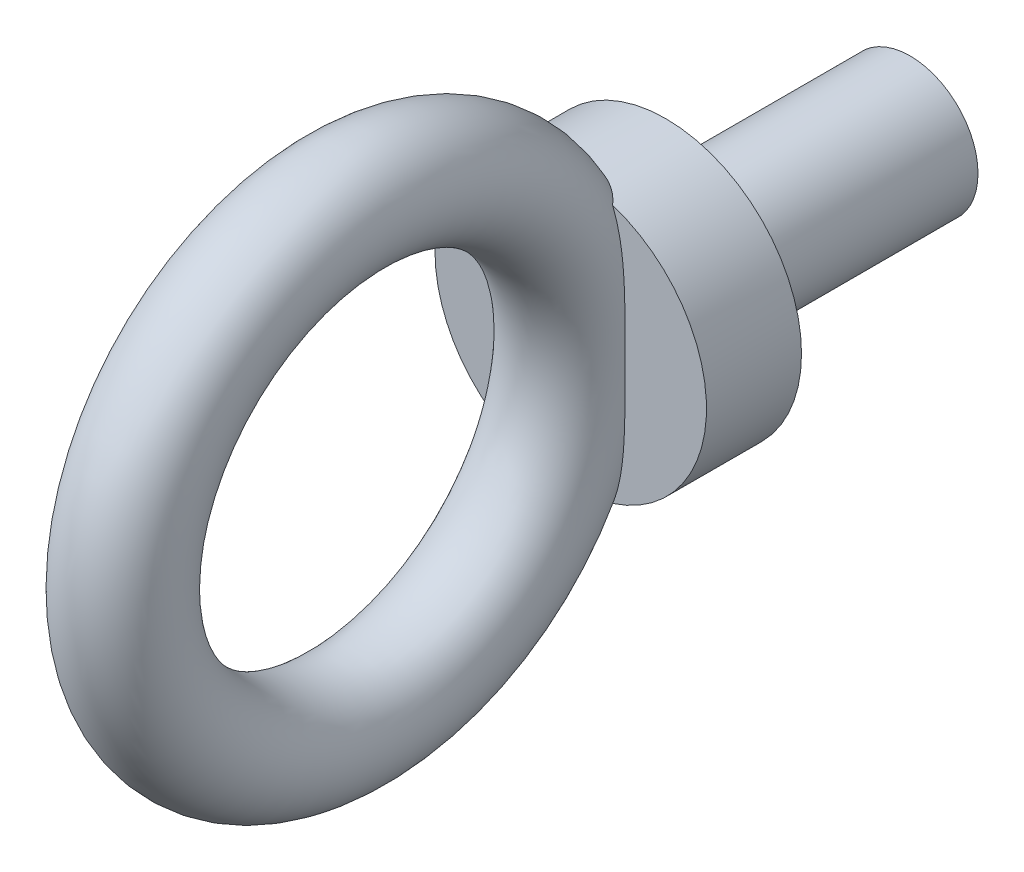
from build123d import *

# Parameters (mm, degrees)
SKETCH_1_R      = 5
EXTRUDE_1_DEPTH = 25
SKETCH_2_R      = 4
SKETCH_4_R      = 10
EXTRUDE_2_DEPTH = 7


with BuildPart() as part:
    # ｽｹｯﾁ1 → ﾎﾞｽ - 押し出し1 (new body)
    with BuildSketch(Plane.XY):
        Circle(SKETCH_1_R)
    extrude(amount=EXTRUDE_1_DEPTH)

    # ｽｲｰﾌﾟ1: sweep along a path in ｽｹｯﾁ3
    with BuildLine(Plane(origin=(0, 0, 0), x_dir=(0, 0, -1), z_dir=(1, 0, 0))) as sweep_1_path:
        CenterArc((-41.5, 0), 16.5, 0, 360)
    # ｽｹｯﾁ2 → ｽｲｰﾌﾟ1 (sweep)
    with BuildSketch(Plane(origin=(0, 0, 0), x_dir=(1, 0, 0), z_dir=(0, 1, 0))):
        with Locations((0, -25)):
            Circle(SKETCH_2_R)
    sweep(path=sweep_1_path.line)

    # ｽｹｯﾁ4 → ﾎﾞｽ - 押し出し2 (add)
    with BuildSketch(Plane(origin=(0, 0, 18), x_dir=(-1, 0, 0), z_dir=(0, 0, -1))):
        Circle(SKETCH_4_R)
    extrude(amount=-EXTRUDE_2_DEPTH)


solid = part.part
